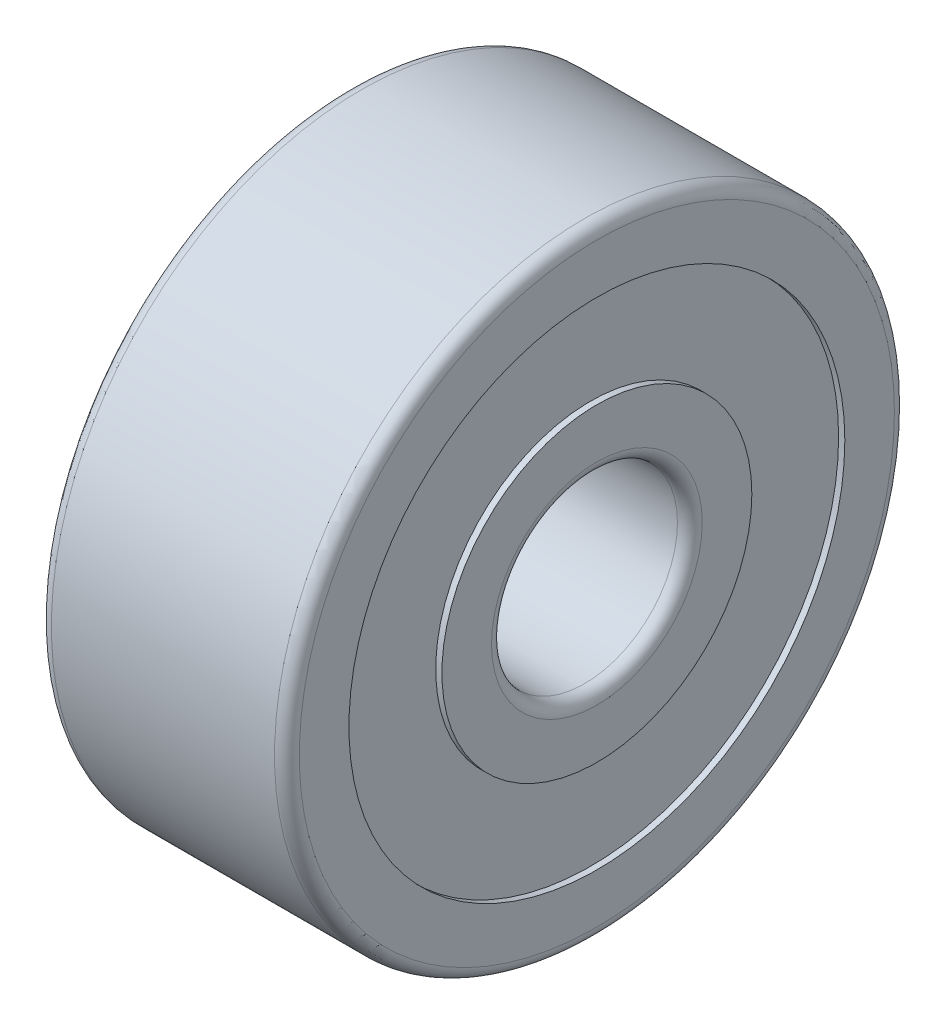
from build123d import *

# Parameters (mm, degrees)
BOSS_EXTRUDE1_DEPTH      = 2
BOSS_EXTRUDE1_DEPTH_BACK = 2
SKETCH1_R                = 5
SKETCH1_R_2              = 1.5
FILLET1_R                = 0.2
SKETCH2_R                = 4
SKETCH2_R_2              = 2.5
CUT_EXTRUDE1_DEPTH       = 0.1
CUT_EXTRUDE2_START       = -0.1
SKETCH3_R                = 4
SKETCH3_R_2              = 2.5
CUT_EXTRUDE2_DEPTH       = 0.1


with BuildPart() as part:
    # Sketch1 → Boss-Extrude1 (new, two sides: drawn at the far end of the back side and taken through both)
    with BuildSketch(Plane(origin=(0, 0, 0), x_dir=(0, 0, -1), z_dir=(1, 0, 0)).offset(-BOSS_EXTRUDE1_DEPTH_BACK)):
        Circle(SKETCH1_R)
        Circle(SKETCH1_R_2, mode=Mode.SUBTRACT)
    extrude(amount=BOSS_EXTRUDE1_DEPTH + BOSS_EXTRUDE1_DEPTH_BACK)

    # Fillet1
    fillet1_edges = [part.edges().sort_by_distance(p)[0] for p in [
        (-2, 0, 1.5),
        (2, 0, 1.5),
        (-2, 0, 5),
        (2, 0, 5),
    ]]
    fillet(fillet1_edges, radius=FILLET1_R)

    # Sketch2 → Cut-Extrude1 (cut)
    with BuildSketch(Plane(origin=(2, 0, 0), x_dir=(0, 0, -1), z_dir=(1, 0, 0))):
        Circle(SKETCH2_R)
        Circle(SKETCH2_R_2, mode=Mode.SUBTRACT)
    extrude(amount=-CUT_EXTRUDE1_DEPTH, mode=Mode.SUBTRACT)

    # Sketch3 → Cut-Extrude2 (cut)
    with BuildSketch(Plane.ZY.offset(2).offset(CUT_EXTRUDE2_START)):
        Circle(SKETCH3_R)
        Circle(SKETCH3_R_2, mode=Mode.SUBTRACT)
    extrude(amount=CUT_EXTRUDE2_DEPTH, mode=Mode.SUBTRACT)


solid = part.part
